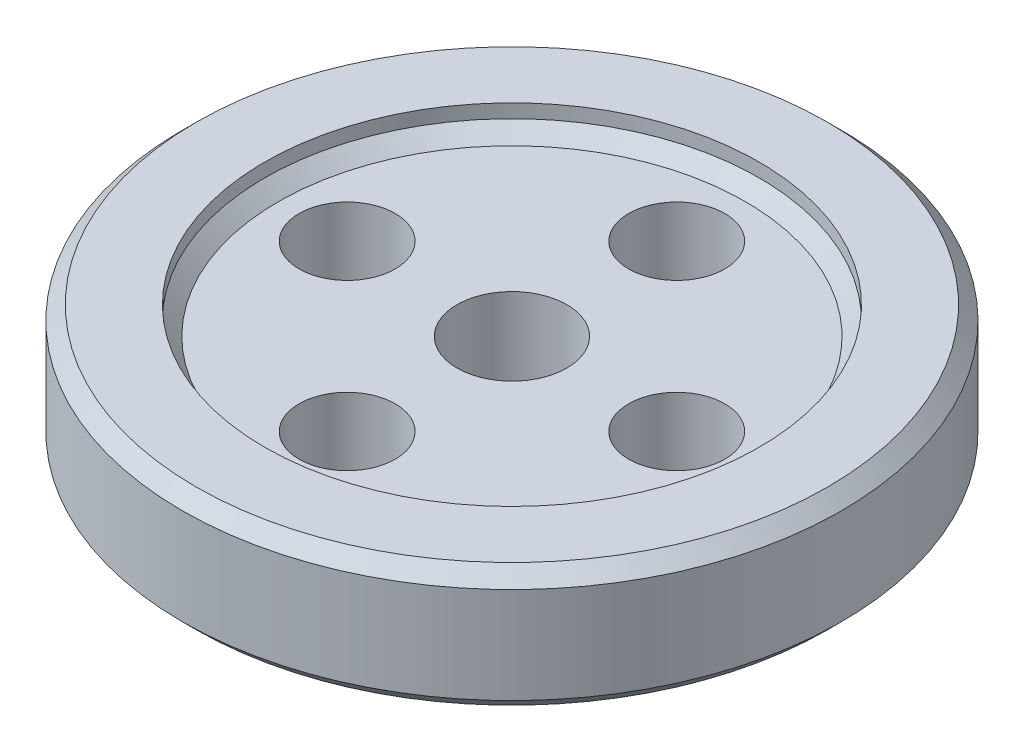
from build123d import *

# Parameters (mm, degrees)
SKETCH2_R           = 24
SKETCH2_R_2         = 18
BOSS_EXTRUDE2_DEPTH = 9
SKETCH2_3_R         = 18
SKETCH2_3_R_2       = 3.5
SKETCH2_3_R_3       = 4
BOSS_EXTRUDE3_DEPTH = 7
CHAMFER1_SIZE       = 1
CHAMFER3_SIZE       = 1


with BuildPart() as part:
    # Sketch2 → Boss-Extrude2 (new body)
    with BuildSketch(Plane(origin=(0, 0, 0), x_dir=(1, 0, 0), z_dir=(0, 1, 0))):
        Circle(SKETCH2_R)
        Circle(SKETCH2_R_2, mode=Mode.SUBTRACT)
    extrude(amount=BOSS_EXTRUDE2_DEPTH)

    # Sketch2<3> → Boss-Extrude3 (add)
    with BuildSketch(Plane(origin=(0, 0, 0), x_dir=(1, 0, 0), z_dir=(0, 1, 0))):
        Circle(SKETCH2_3_R)
        with Locations((-12, 0)):
            Circle(SKETCH2_3_R_2, mode=Mode.SUBTRACT)
        with Locations((0, -12)):
            Circle(SKETCH2_3_R_2, mode=Mode.SUBTRACT)
        with Locations((12, 0)):
            Circle(SKETCH2_3_R_2, mode=Mode.SUBTRACT)
        Circle(SKETCH2_3_R_3, mode=Mode.SUBTRACT)
        with Locations((0, 12)):
            Circle(SKETCH2_3_R_2, mode=Mode.SUBTRACT)
    extrude(amount=BOSS_EXTRUDE3_DEPTH)

    # Chamfer1
    chamfer1_edges = [part.edges().sort_by_distance(p)[0] for p in [
        (-24, 0, 0),
        (-24, 9, 0),
    ]]
    chamfer(chamfer1_edges, length=CHAMFER1_SIZE)

    # Chamfer3
    chamfer3_edges = [part.edges().sort_by_distance(p)[0] for p in [
        (-18, 7, 0),
    ]]
    chamfer(chamfer3_edges, length=CHAMFER3_SIZE)


solid = part.part
